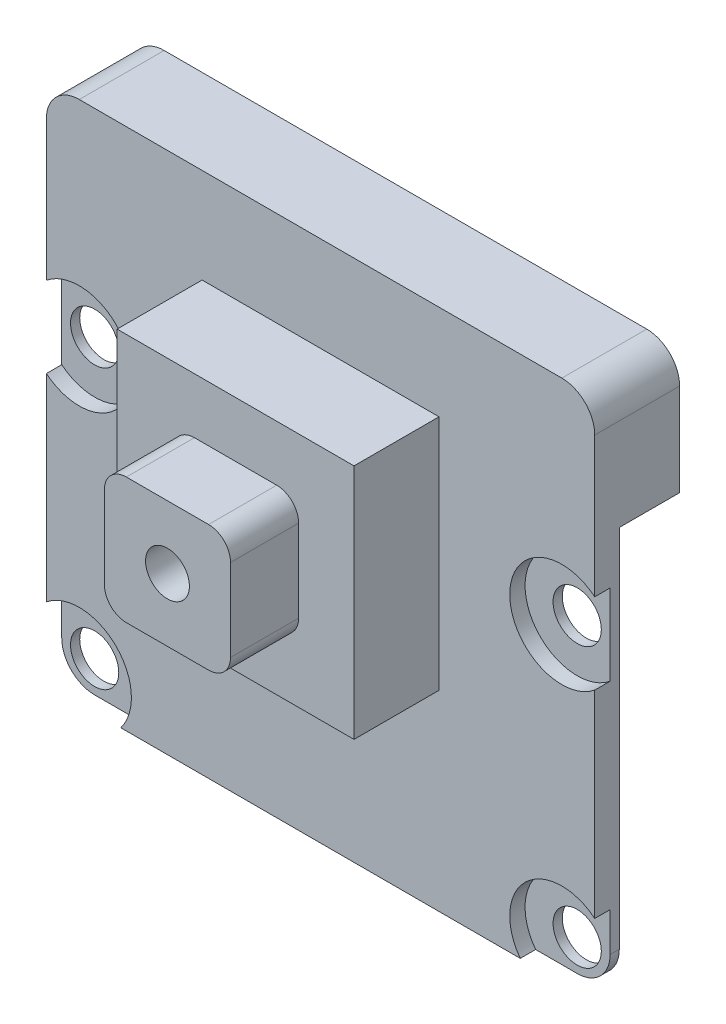
from build123d import *

# Parameters (mm, degrees)
SKETCH1_W           = 25
SKETCH1_H           = 23.86
BOSS_EXTRUDE1_DEPTH = 1.12
SKETCH4_W           = 10.8
SKETCH4_H           = 10.8
BOSS_EXTRUDE2_DEPTH = 3.875
SKETCH5_R           = 2.375
CUT_EXTRUDE1_DEPTH  = 0.7
CUT_EXTRUDE2_REACH  = 19.708
SKETCH6_R           = 1.1
SKETCH8_R           = 1
BOSS_EXTRUDE3_DEPTH = 6.98
SKETCH9_W           = 25
SKETCH9_H           = 5.71
BOSS_EXTRUDE4_DEPTH = 2.75
FILLET1_R           = 1.5


with BuildPart() as part:
    # Sketch1 → Boss-Extrude1 (new body)
    with BuildSketch(Plane.XY):
        Rectangle(SKETCH1_W, SKETCH1_H)
    extrude(amount=BOSS_EXTRUDE1_DEPTH)

    # Sketch4 → Boss-Extrude2 (add)
    with BuildSketch(Plane.XY.offset(1.12)):
        with Locations((0, 2.2016)):
            Rectangle(SKETCH4_W, SKETCH4_H)
    extrude(amount=BOSS_EXTRUDE2_DEPTH)

    # Sketch5 → Cut-Extrude1 (cut)
    with BuildSketch(Plane.XY.offset(1.12)):
        with Locations((11, 2.2016)):
            Circle(SKETCH5_R)
        with Locations((11, -10.4984)):
            Circle(SKETCH5_R)
        with Locations((-11, -10.4984)):
            Circle(SKETCH5_R)
        with Locations((-11, 2.2016)):
            Circle(SKETCH5_R)
    extrude(amount=-CUT_EXTRUDE1_DEPTH, mode=Mode.SUBTRACT)

    # Sketch6 → Cut-Extrude2 (cut, up to next)
    with BuildSketch(Plane.XY.offset(1.12), mode=Mode.PRIVATE) as cut_extrude2_sk1:
        with Locations((11, 2.2016)):
            Circle(SKETCH6_R)
    cut_extrude2_tool1 = extrude(cut_extrude2_sk1.sketch, amount=-CUT_EXTRUDE2_REACH, mode=Mode.PRIVATE) & part.part
    # Sketch6 → Cut-Extrude2 (cut, up to next)
    with BuildSketch(Plane.XY.offset(1.12), mode=Mode.PRIVATE) as cut_extrude2_sk2:
        with Locations((11, -10.4984)):
            Circle(SKETCH6_R)
    cut_extrude2_tool2 = extrude(cut_extrude2_sk2.sketch, amount=-CUT_EXTRUDE2_REACH, mode=Mode.PRIVATE) & part.part
    # Sketch6 → Cut-Extrude2 (cut, up to next)
    with BuildSketch(Plane.XY.offset(1.12), mode=Mode.PRIVATE) as cut_extrude2_sk3:
        with Locations((-11, -10.4984)):
            Circle(SKETCH6_R)
    cut_extrude2_tool3 = extrude(cut_extrude2_sk3.sketch, amount=-CUT_EXTRUDE2_REACH, mode=Mode.PRIVATE) & part.part
    # Sketch6 → Cut-Extrude2 (cut, up to next)
    with BuildSketch(Plane.XY.offset(1.12), mode=Mode.PRIVATE) as cut_extrude2_sk4:
        with Locations((-11, 2.2016)):
            Circle(SKETCH6_R)
    cut_extrude2_tool4 = extrude(cut_extrude2_sk4.sketch, amount=-CUT_EXTRUDE2_REACH, mode=Mode.PRIVATE) & part.part
    add(cut_extrude2_tool1.solids().sort_by_distance((11, 2.2016, 1.12))[0], mode=Mode.SUBTRACT)
    add(cut_extrude2_tool2.solids().sort_by_distance((11, -10.4984, 1.12))[0], mode=Mode.SUBTRACT)
    add(cut_extrude2_tool3.solids().sort_by_distance((-11, -10.4984, 1.12))[0], mode=Mode.SUBTRACT)
    add(cut_extrude2_tool4.solids().sort_by_distance((-11, 2.2016, 1.12))[0], mode=Mode.SUBTRACT)

    # Sketch8 → Boss-Extrude3 (add)
    with BuildSketch(Plane.XY.offset(1.12)):
        with BuildLine():
            Line((2.875, 4.0766), (2.875, 0.3266))
            ThreePointArc((2.875, 0.3266), (2.582106781, -0.380506781), (1.875, -0.6734))
            Line((1.875, -0.6734), (-1.875, -0.6734))
            ThreePointArc((-1.875, -0.6734), (-2.582106781, -0.380506781), (-2.875, 0.3266))
            Line((-2.875, 0.3266), (-2.875, 4.0766))
            ThreePointArc((-2.875, 4.0766), (-2.582106781, 4.783706781), (-1.875, 5.0766))
            Line((-1.875, 5.0766), (1.875, 5.0766))
            ThreePointArc((1.875, 5.0766), (2.582106781, 4.783706781), (2.875, 4.0766))
        make_face()
        with Locations((0, 2.2016)):
            Circle(SKETCH8_R, mode=Mode.SUBTRACT)
    extrude(amount=BOSS_EXTRUDE3_DEPTH)

    # Sketch9 → Boss-Extrude4 (add)
    with BuildSketch(Plane(origin=(0, 0, 0), x_dir=(-1, 0, 0), z_dir=(0, 0, -1))):
        with Locations((0, 9.075)):
            Rectangle(SKETCH9_W, SKETCH9_H)
    extrude(amount=BOSS_EXTRUDE4_DEPTH)

    # Fillet1
    fillet1_edges = [part.edges().sort_by_distance(p)[0] for p in [
        (12.5, -11.93, 0.21),
        (-12.5, -11.93, 0.21),
        (12.5, 11.93, -0.815),
        (-12.5, 11.93, -0.815),
    ]]
    fillet(fillet1_edges, radius=FILLET1_R)


solid = part.part
